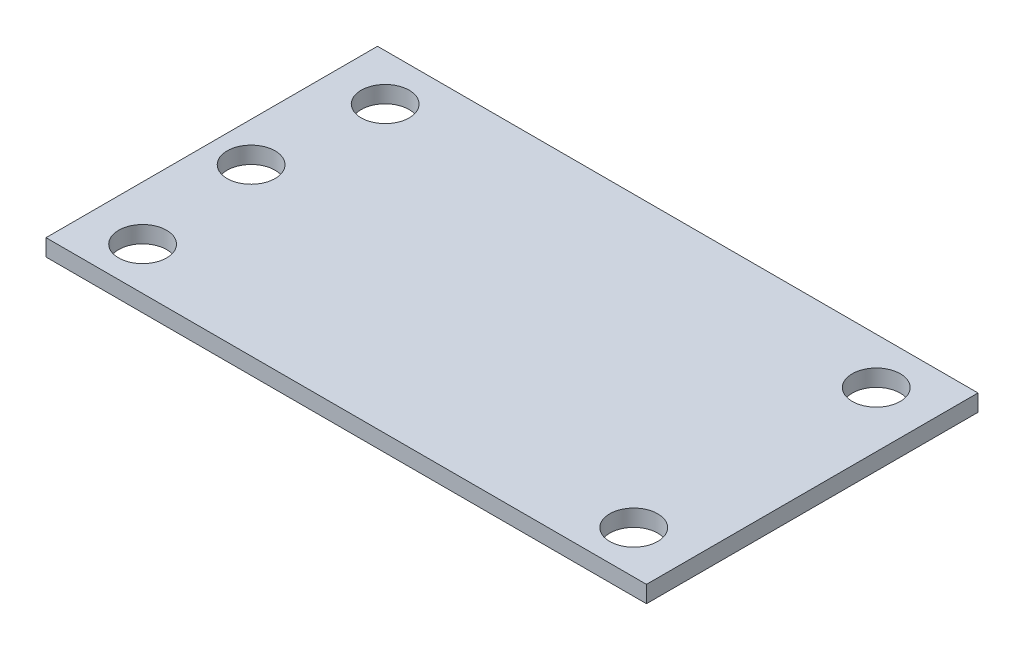
from build123d import *

# Parameters (mm, degrees)
SKETCH4_W               = 250.263322682
SKETCH4_H               = 138.169331444
BOSS_EXTRUDE1_DEPTH     = 7
CUT_EXTRUDE1_DEPTH      = 60
CUT_EXTRUDE1_DEPTH_BACK = 144.107035844
SKETCH5_R               = 10
CUT_EXTRUDE6_DEPTH      = 68
CUT_EXTRUDE6_DEPTH_BACK = 76
SKETCH9_R               = 10


with BuildPart() as part:
    # Sketch4 → Boss-Extrude1 (new body)
    with BuildSketch(Plane(origin=(0, 0, 0), x_dir=(1, 0, 0), z_dir=(0, 1, 0))):
        Rectangle(SKETCH4_W, SKETCH4_H)
    extrude(amount=BOSS_EXTRUDE1_DEPTH)

    # Sketch5 → Cut-Extrude1 (cut, two sides: drawn at the far end of the back side and taken through both)
    with BuildSketch(Plane(origin=(0, 0, 0), x_dir=(1, 0, 0), z_dir=(0, 1, 0)).offset(-CUT_EXTRUDE1_DEPTH_BACK)):
        with Locations(Location((-102.685331177, 49.826038164, 0), (0, 0, 90))):
            Circle(SKETCH5_R)
        with Locations(Location((101.994027262, 49.826038164, 0), (0, 0, 90))):
            Circle(SKETCH5_R)
        with Locations(Location((101.994027262, -51.263637619, 0), (0, 0, 90))):
            Circle(SKETCH5_R)
        with Locations(Location((-102.685331177, -51.263637619, 0), (0, 0, 90))):
            Circle(SKETCH5_R)
    extrude(amount=CUT_EXTRUDE1_DEPTH + CUT_EXTRUDE1_DEPTH_BACK, mode=Mode.SUBTRACT)

    # Sketch9 → Cut-Extrude6 (cut, two sides: drawn at the far end of the back side and taken through both)
    with BuildSketch(Plane(origin=(0, 0, 0), x_dir=(1, 0, 0), z_dir=(0, 1, 0)).offset(-CUT_EXTRUDE6_DEPTH_BACK)):
        with Locations(Location((-108.72678805, 0, 0), (0, 0, 90))):
            Circle(SKETCH9_R)
    extrude(amount=CUT_EXTRUDE6_DEPTH + CUT_EXTRUDE6_DEPTH_BACK, mode=Mode.SUBTRACT)


solid = part.part
